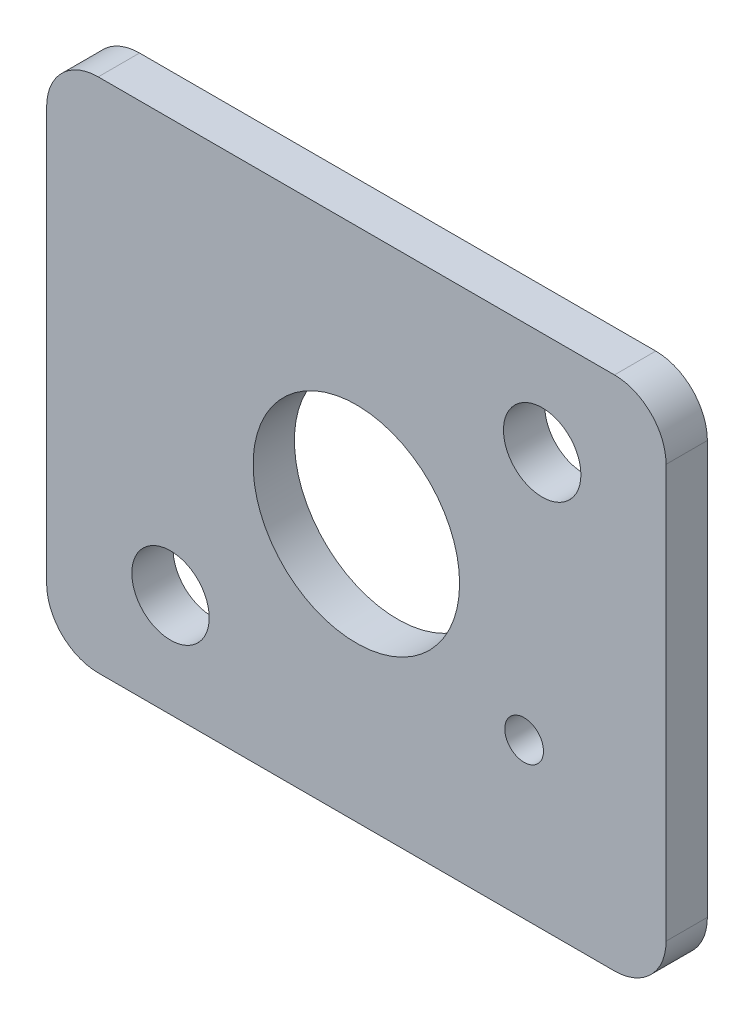
from build123d import *

# Parameters (mm, degrees)
SKETCH_1_W          = 12
SKETCH_1_H          = 10
EXTRUDE_1_DEPTH     = 0.8
CUT_EXTRUDE_1_REACH = 9.851
SKETCH_2_R          = 2
SKETCH_2_R_2        = 0.75
SKETCH_2_R_3        = 0.375
FILLET_1_R          = 1


with BuildPart() as part:
    # Эскиз1 → Бобышка-Вытянуть1 (new body)
    with BuildSketch(Plane.XY):
        Rectangle(SKETCH_1_W, SKETCH_1_H)
    extrude(amount=EXTRUDE_1_DEPTH)

    # Эскиз2 → Вырез-Вытянуть1 (cut, up to next)
    with BuildSketch(Plane.XY.offset(0.8), mode=Mode.PRIVATE) as cut_extrude_1_sk1:
        Circle(SKETCH_2_R)
    cut_extrude_1_tool1 = extrude(cut_extrude_1_sk1.sketch, amount=-CUT_EXTRUDE_1_REACH, mode=Mode.PRIVATE) & part.part
    # Эскиз2 → Вырез-Вытянуть1 (cut, up to next)
    with BuildSketch(Plane.XY.offset(0.8), mode=Mode.PRIVATE) as cut_extrude_1_sk2:
        with Locations((-3.6, -3)):
            Circle(SKETCH_2_R_2)
    cut_extrude_1_tool2 = extrude(cut_extrude_1_sk2.sketch, amount=-CUT_EXTRUDE_1_REACH, mode=Mode.PRIVATE) & part.part
    # Эскиз2 → Вырез-Вытянуть1 (cut, up to next)
    with BuildSketch(Plane.XY.offset(0.8), mode=Mode.PRIVATE) as cut_extrude_1_sk3:
        with Locations((3.6, 3)):
            Circle(SKETCH_2_R_2)
    cut_extrude_1_tool3 = extrude(cut_extrude_1_sk3.sketch, amount=-CUT_EXTRUDE_1_REACH, mode=Mode.PRIVATE) & part.part
    # Эскиз2 → Вырез-Вытянуть1 (cut, up to next)
    with BuildSketch(Plane.XY.offset(0.8), mode=Mode.PRIVATE) as cut_extrude_1_sk4:
        with Locations((3.25, -2)):
            Circle(SKETCH_2_R_3)
    cut_extrude_1_tool4 = extrude(cut_extrude_1_sk4.sketch, amount=-CUT_EXTRUDE_1_REACH, mode=Mode.PRIVATE) & part.part
    add(cut_extrude_1_tool1.solids().sort_by_distance((0, 0, 0.8))[0], mode=Mode.SUBTRACT)
    add(cut_extrude_1_tool2.solids().sort_by_distance((-3.6, -3, 0.8))[0], mode=Mode.SUBTRACT)
    add(cut_extrude_1_tool3.solids().sort_by_distance((3.6, 3, 0.8))[0], mode=Mode.SUBTRACT)
    add(cut_extrude_1_tool4.solids().sort_by_distance((3.25, -2, 0.8))[0], mode=Mode.SUBTRACT)

    # Скругление1
    fillet_1_edges = [part.edges().sort_by_distance(p)[0] for p in [
        (6, -5, 0.4),
        (-6, -5, 0.4),
        (-6, 5, 0.4),
        (6, 5, 0.4),
    ]]
    fillet(fillet_1_edges, radius=FILLET_1_R)


solid = part.part
